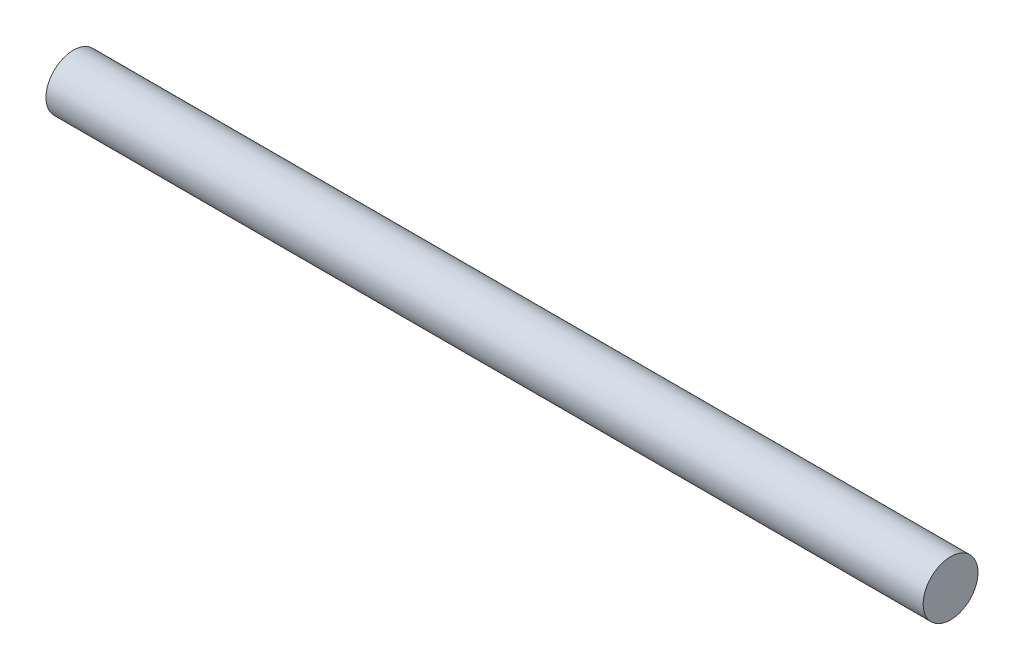
from build123d import *

# Parameters (mm, degrees)
BASES_R    = 1.25
BASE_DEPTH = 20


with BuildPart() as part:
    # BaseS → Base (new, symmetric)
    with BuildSketch(Plane(origin=(0, 0, 0), x_dir=(0, 0, -1), z_dir=(1, 0, 0))):
        Circle(BASES_R)
    extrude(amount=BASE_DEPTH, both=True)


solid = part.part
